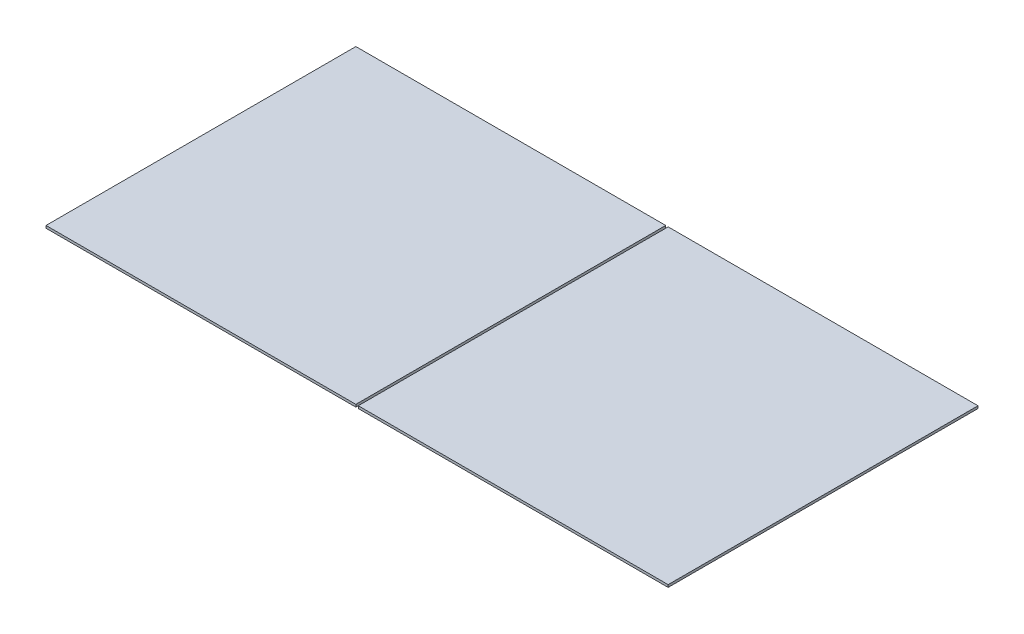
from build123d import *

# Parameters (mm, degrees)
SKETCH1_W             = 127
SKETCH1_H             = 127
BOSS_EXTRUDE1_DEPTH   = 1
BOSS_EXTRUDE1_2_DEPTH = 1


with BuildPart() as part:
    # Sketch1 → Boss-Extrude1 (new body)
    with BuildSketch(Plane(origin=(0, 0, 0), x_dir=(1, 0, 0), z_dir=(0, 1, 0))):
        with Locations((128, 0)):
            Rectangle(SKETCH1_W, SKETCH1_H)
    extrude(amount=BOSS_EXTRUDE1_DEPTH)


with BuildPart() as body_2:
    # Sketch1 → Boss-Extrude1 2 (new body)
    with BuildSketch(Plane(origin=(0, 0, 0), x_dir=(1, 0, 0), z_dir=(0, 1, 0))):
        Rectangle(SKETCH1_W, SKETCH1_H)
    extrude(amount=BOSS_EXTRUDE1_2_DEPTH)


solid = Compound([part.part, body_2.part])
